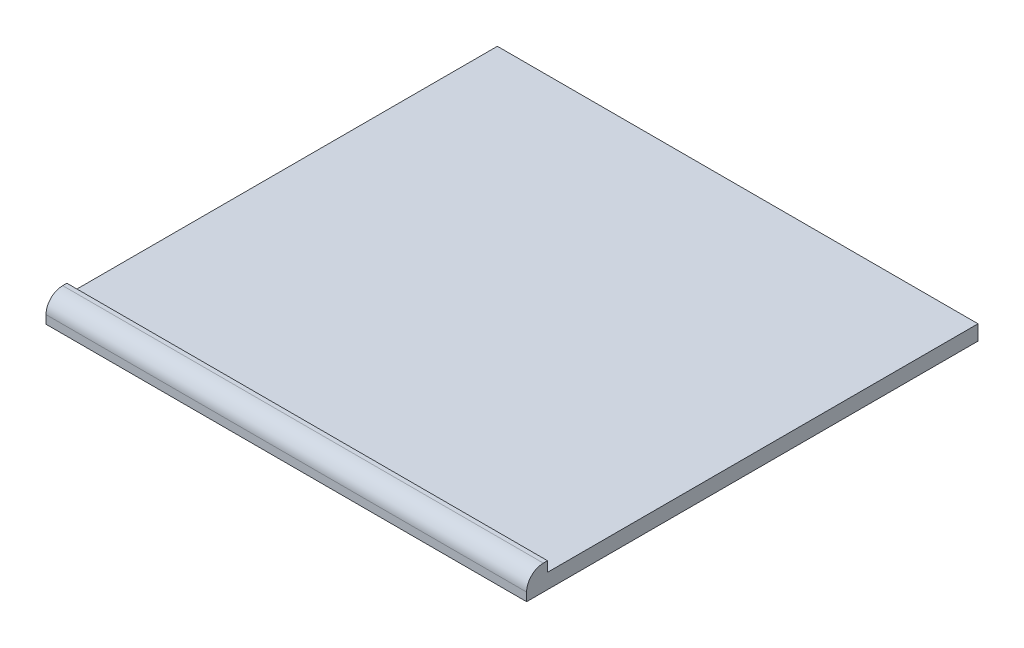
from build123d import *

# Parameters (mm, degrees)
SKETCH2_W           = 57.5
SKETCH2_H           = 54
BOSS_EXTRUDE1_DEPTH = 1.8
SKETCH3_W           = 57.5
SKETCH3_H           = 2.5
BOSS_EXTRUDE2_DEPTH = 1.2
FILLET1_R           = 2


with BuildPart() as part:
    # Sketch2 → Boss-Extrude1 (new body)
    with BuildSketch(Plane(origin=(0, 0, 0), x_dir=(1, 0, 0), z_dir=(0, 1, 0))):
        with Locations((28.75, 27)):
            Rectangle(SKETCH2_W, SKETCH2_H)
    extrude(amount=BOSS_EXTRUDE1_DEPTH)

    # Sketch3 → Boss-Extrude2 (add)
    with BuildSketch(Plane(origin=(0, 1.8, 0), x_dir=(1, 0, 0), z_dir=(0, 1, 0))):
        with Locations((28.75, 1.25)):
            Rectangle(SKETCH3_W, SKETCH3_H)
    extrude(amount=BOSS_EXTRUDE2_DEPTH)

    # Fillet1
    fillet1_edges = [part.edges().sort_by_distance(p)[0] for p in [
        (28.75, 3, 0),
    ]]
    fillet(fillet1_edges, radius=FILLET1_R)


solid = part.part
